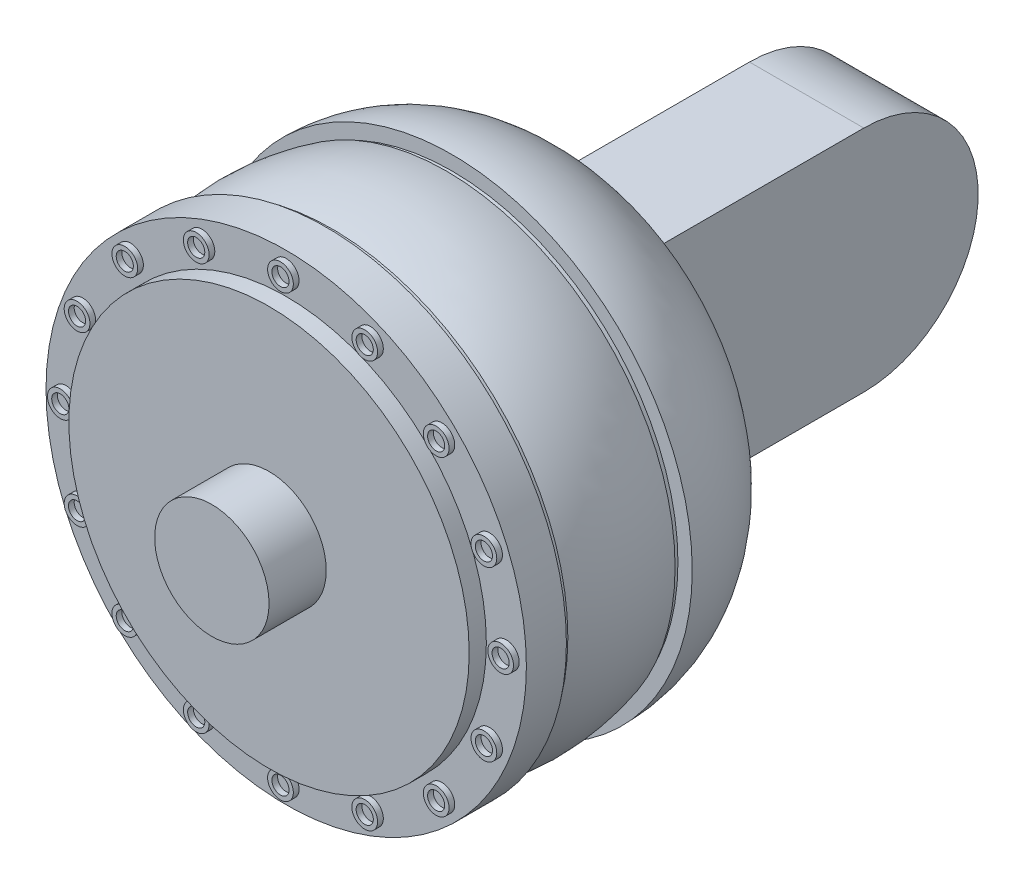
from build123d import *

# Parameters (mm, degrees)
SKETCH2_R           = 39.5
BOSS_EXTRUDE1_DEPTH = 1
SKETCH4_R           = 41.25
BOSS_EXTRUDE2_DEPTH = 1
SKETCH5_R           = 42
BOSS_EXTRUDE3_DEPTH = 7
SKETCH6_R           = 35
BOSS_EXTRUDE4_DEPTH = 3
SKETCH7_R           = 2.25
SKETCH7_R_2         = 1.5
BOSS_EXTRUDE5_DEPTH = 1
CIRPATTERN1_COUNT   = 16
SKETCH8_W           = 20
SKETCH8_H           = 40
BOSS_EXTRUDE6_DEPTH = 42
SKETCH9_R           = 20
BOSS_EXTRUDE7_DEPTH = 20
SKETCH10_R          = 10
BOSS_EXTRUDE8_DEPTH = 10
SKETCH11_R          = 10
BOSS_EXTRUDE9_DEPTH = 10


with BuildPart() as part:
    # Sketch1 → Revolve1 (revolve)
    with BuildSketch(Plane(origin=(0, 0, 0), x_dir=(1, 0, 0), z_dir=(0, 1, 0))):
        with BuildLine():
            Line((0, 0), (0, -20))
            Line((0, -20), (-42, -20))
            ThreePointArc((-42, -20), (-39.360679775, -8.819660113), (-32, 0))
            Line((-32, 0), (0, 0))
        make_face()
    revolve(axis=Axis((0, 0, 0), (0, 0, 1)))

    # Sketch2 → Boss-Extrude1 (add)
    with BuildSketch(Plane.XY.offset(20)):
        Circle(SKETCH2_R)
    extrude(amount=BOSS_EXTRUDE1_DEPTH)

    # Sketch3 → Revolve2 (revolve)
    with BuildSketch(Plane(origin=(0, 0, 0), x_dir=(1, 0, 0), z_dir=(0, 1, 0))):
        with BuildLine():
            Line((0, -21), (-40, -21))
            ThreePointArc((-40, -21), (-41.376973739, -31), (-40, -41))
            Line((-40, -41), (0, -41))
            Line((0, -41), (0, -21))
        make_face()
    revolve(axis=Axis((0, 0, 21), (0, 0, 1)))

    # Sketch4 → Boss-Extrude2 (add)
    with BuildSketch(Plane.XY.offset(41)):
        Circle(SKETCH4_R)
    extrude(amount=BOSS_EXTRUDE2_DEPTH)

    # Sketch5 → Boss-Extrude3 (add)
    with BuildSketch(Plane.XY.offset(42)):
        Circle(SKETCH5_R)
    extrude(amount=BOSS_EXTRUDE3_DEPTH)

    # Sketch6 → Boss-Extrude4 (add)
    with BuildSketch(Plane.XY.offset(49)):
        Circle(SKETCH6_R)
    extrude(amount=BOSS_EXTRUDE4_DEPTH)

    # Sketch7 → Boss-Extrude5 (add)
    with BuildSketch(Plane.XY.offset(49)):
        with Locations((38.5, 0)):
            Circle(SKETCH7_R)
        with Locations((38.5, 0)):
            Circle(SKETCH7_R_2, mode=Mode.SUBTRACT)
    boss_extrude5 = extrude(amount=BOSS_EXTRUDE5_DEPTH)

    # CirPattern1: Boss-Extrude5 ×16 about axis
    cirpattern1_axis = Axis((0, 0, 0), (0, 0, 1))
    for i in range(1, CIRPATTERN1_COUNT):
        add(boss_extrude5.rotate(cirpattern1_axis, i * 360 / CIRPATTERN1_COUNT))

    # Sketch8 → Boss-Extrude6 (add)
    with BuildSketch(Plane(origin=(0, 0, 0), x_dir=(-1, 0, 0), z_dir=(0, 0, -1))):
        Rectangle(SKETCH8_W, SKETCH8_H)
    extrude(amount=BOSS_EXTRUDE6_DEPTH)

    # Sketch9 → Boss-Extrude7 (add)
    with BuildSketch(Plane.ZY.offset(10)):
        with Locations((-42, 0)):
            Circle(SKETCH9_R)
    extrude(amount=-BOSS_EXTRUDE7_DEPTH)

    # Sketch10 → Boss-Extrude8 (add)
    with BuildSketch(Plane.ZY.offset(10)):
        with Locations(Location((-42, 0, 0), (0, 0, 90))):
            Circle(SKETCH10_R)
    extrude(amount=BOSS_EXTRUDE8_DEPTH)

    # Sketch11 → Boss-Extrude9 (add)
    with BuildSketch(Plane.XY.offset(52)):
        Circle(SKETCH11_R)
    extrude(amount=BOSS_EXTRUDE9_DEPTH)


solid = part.part
